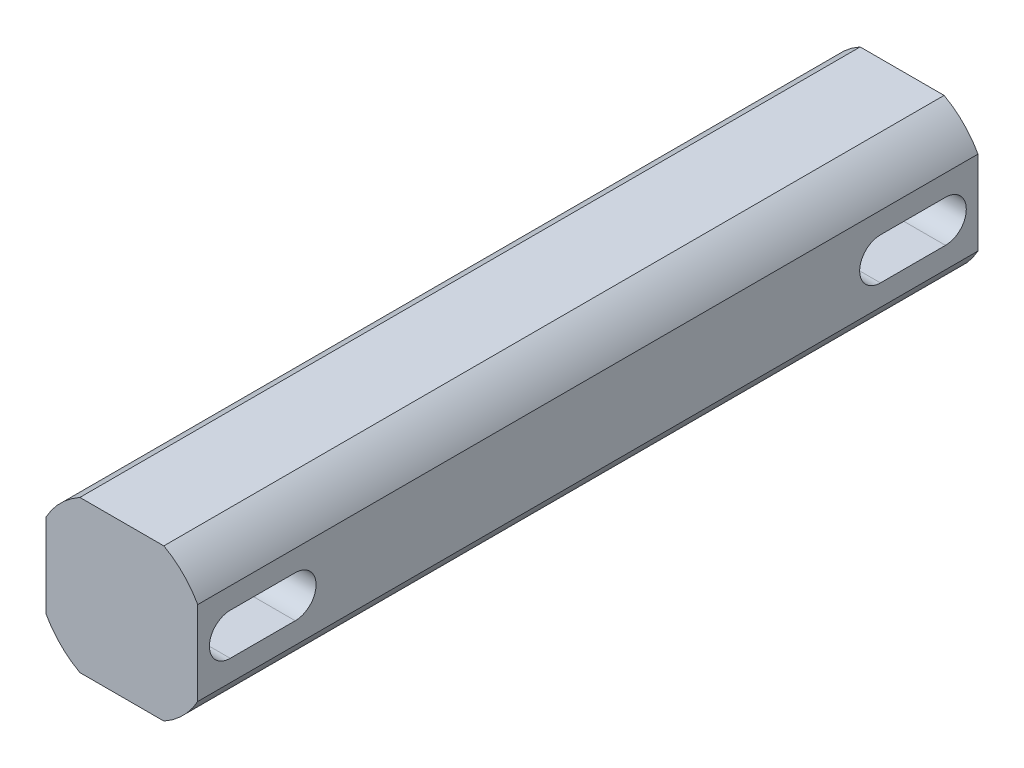
from build123d import *

# Parameters (mm, degrees)
SKETCH1_R               = 6.35
BOSS_EXTRUDE1_DEPTH     = 28.575
CUT_EXTRUDE1_DEPTH      = 28.575
CUT_EXTRUDE1_DEPTH_BACK = 28.575
SKETCH3_OUTSIDE_W       = 26.682
SKETCH3_OUTSIDE_H       = 26.682
SKETCH3_OUTSIDE_W_2     = 11.1125
SKETCH3_OUTSIDE_H_2     = 11.1125
CUT_EXTRUDE2_REACH      = 33.159


with BuildPart() as part:
    # Sketch1 → Boss-Extrude1 (new, symmetric)
    with BuildSketch(Plane.XY):
        Circle(SKETCH1_R)
    extrude(amount=BOSS_EXTRUDE1_DEPTH, both=True)

    # Sketch3 outside → Cut-Extrude1 (cut, two sides: drawn at the far end of the back side and taken through both)
    with BuildSketch(Plane.XY.offset(-CUT_EXTRUDE1_DEPTH_BACK)):
        Rectangle(SKETCH3_OUTSIDE_W, SKETCH3_OUTSIDE_H)
        Rectangle(SKETCH3_OUTSIDE_W_2, SKETCH3_OUTSIDE_H_2, mode=Mode.SUBTRACT)
    extrude(amount=CUT_EXTRUDE1_DEPTH + CUT_EXTRUDE1_DEPTH_BACK, mode=Mode.SUBTRACT)

    # Sketch4 → Cut-Extrude2 (cut, up to next)
    with BuildSketch(Plane.ZY.offset(5.55625), mode=Mode.PRIVATE) as cut_extrude2_sk1:
        with BuildLine():
            Line((-26.19375, 1.524), (-21.43125, 1.524))
            ThreePointArc((-21.43125, 1.524), (-19.90725, 0), (-21.43125, -1.524))
            Line((-21.43125, -1.524), (-26.19375, -1.524))
            ThreePointArc((-26.19375, -1.524), (-27.71775, 0), (-26.19375, 1.524))
        make_face()
    cut_extrude2_tool1 = extrude(cut_extrude2_sk1.sketch, amount=-CUT_EXTRUDE2_REACH, mode=Mode.PRIVATE) & part.part
    # Sketch4 → Cut-Extrude2 (cut, up to next)
    with BuildSketch(Plane.ZY.offset(5.55625), mode=Mode.PRIVATE) as cut_extrude2_sk2:
        with BuildLine():
            Line((26.19375, 1.524), (21.43125, 1.524))
            ThreePointArc((21.43125, 1.524), (19.90725, 0), (21.43125, -1.524))
            Line((21.43125, -1.524), (26.19375, -1.524))
            ThreePointArc((26.19375, -1.524), (27.71775, 0), (26.19375, 1.524))
        make_face()
    cut_extrude2_tool2 = extrude(cut_extrude2_sk2.sketch, amount=-CUT_EXTRUDE2_REACH, mode=Mode.PRIVATE) & part.part
    add(cut_extrude2_tool1.solids().sort_by_distance((-5.55625, 0, -23.8125))[0], mode=Mode.SUBTRACT)
    add(cut_extrude2_tool2.solids().sort_by_distance((-5.55625, 0, 23.8125))[0], mode=Mode.SUBTRACT)


solid = part.part
